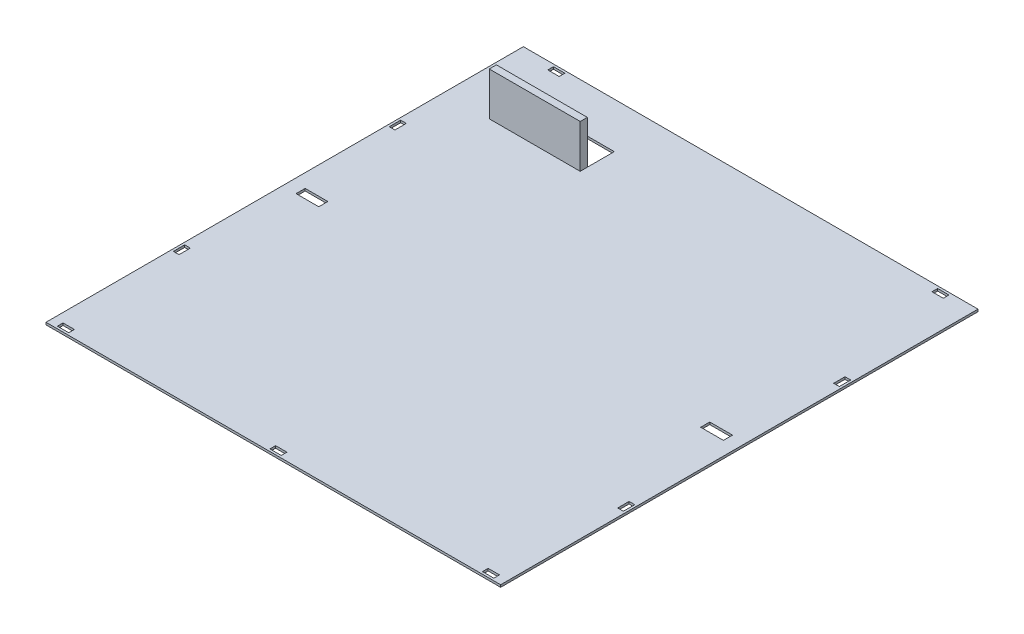
from build123d import *

# Parameters (mm, degrees)
SKETCH1_W           = 200
SKETCH1_H           = 210
SKETCH1_W_2         = 5
SKETCH1_H_2         = 2.5
SKETCH1_W_3         = 2.5
SKETCH1_H_3         = 5
SKETCH1_W_4         = 10
SKETCH1_H_4         = 4
MAINBODY_DEPTH      = 1
SKETCH1_8_W         = 40
SKETCH1_8_H         = 3.124603495
BOSS_EXTRUDE1_DEPTH = 20


with BuildPart() as part:
    # Sketch1 → MainBody (new body)
    with BuildSketch(Plane(origin=(0, 0, 0), x_dir=(1, 0, 0), z_dir=(0, 1, 0))):
        Rectangle(SKETCH1_W, SKETCH1_H)
        with Locations((-93.5, -102.75)):
            Rectangle(SKETCH1_W_2, SKETCH1_H_2, mode=Mode.SUBTRACT)
        with Locations((-97.75, -47.5)):
            Rectangle(SKETCH1_W_3, SKETCH1_H_3, mode=Mode.SUBTRACT)
        with Locations((0, -102.75)):
            Rectangle(SKETCH1_W_2, SKETCH1_H_2, mode=Mode.SUBTRACT)
        with Locations((93.5, -102.75)):
            Rectangle(SKETCH1_W_2, SKETCH1_H_2, mode=Mode.SUBTRACT)
        with Locations((97.75, -47.5)):
            Rectangle(SKETCH1_W_3, SKETCH1_H_3, mode=Mode.SUBTRACT)
        with Locations((-89, 1)):
            Rectangle(SKETCH1_W_4, SKETCH1_H_4, mode=Mode.SUBTRACT)
        with Locations((-97.75, 47.5)):
            Rectangle(SKETCH1_W_3, SKETCH1_H_3, mode=Mode.SUBTRACT)
        Polygon((-80, 70), (-80, 73.124603495), (-80, 85), (-40, 85), (-40, 73.124603495), (-40, 70), align=None, mode=Mode.SUBTRACT)
        with Locations((-83.25, 102.75)):
            Rectangle(SKETCH1_W_2, SKETCH1_H_2, mode=Mode.SUBTRACT)
        with Locations((89, 1)):
            Rectangle(SKETCH1_W_4, SKETCH1_H_4, mode=Mode.SUBTRACT)
        with Locations((97.75, 47.5)):
            Rectangle(SKETCH1_W_3, SKETCH1_H_3, mode=Mode.SUBTRACT)
        with Locations((85.75, 102.75)):
            Rectangle(SKETCH1_W_2, SKETCH1_H_2, mode=Mode.SUBTRACT)
    extrude(amount=MAINBODY_DEPTH)

    # Sketch1<8> → Boss-Extrude1 (add)
    with BuildSketch(Plane(origin=(0, 0, 0), x_dir=(1, 0, 0), z_dir=(0, 1, 0))):
        with Locations((-60, 71.562301748)):
            Rectangle(SKETCH1_8_W, SKETCH1_8_H)
    extrude(amount=BOSS_EXTRUDE1_DEPTH)


solid = part.part
